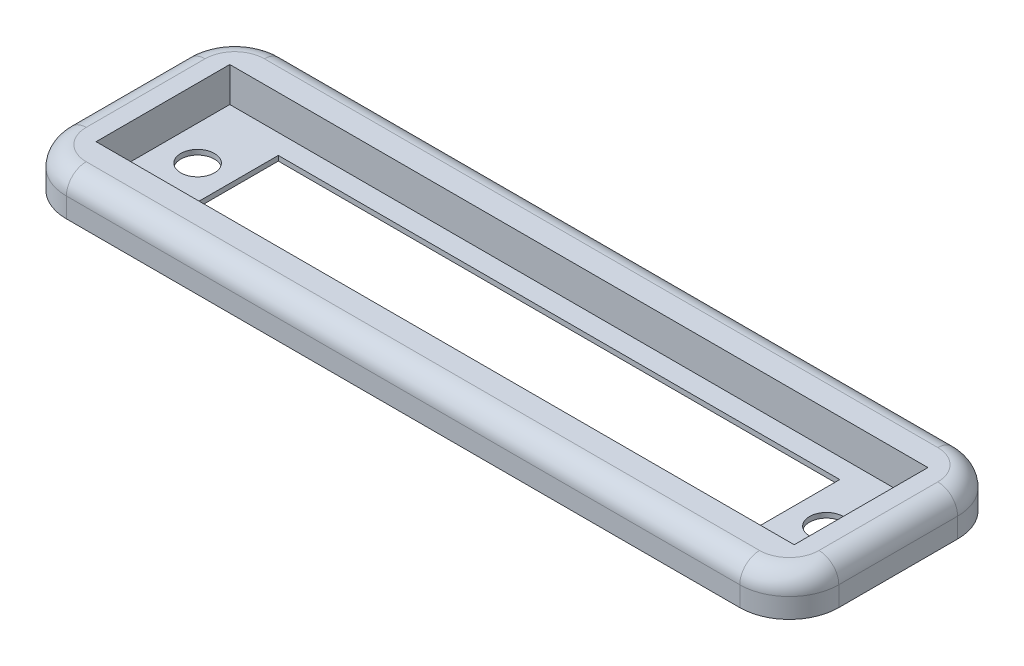
from build123d import *
from OCP.BRepFilletAPI import BRepFilletAPI_MakeFillet

# Parameters (mm, degrees)
SKETCH2_W           = 72
SKETCH2_H           = 18
SKETCH2_R           = 1.7
SKETCH2_W_2         = 56.7
SKETCH2_H_2         = 9.5
BOSS_EXTRUDE2_DEPTH = 0.5
SKETCH3_W           = 78
SKETCH3_H           = 22
SKETCH3_W_2         = 70.5
SKETCH3_H_2         = 13.5
BOSS_EXTRUDE3_DEPTH = 4
FILLET1_R1          = 5
FILLET1_R2          = 2


with BuildPart() as part:
    # Sketch2 → Boss-Extrude2 (new body)
    with BuildSketch(Plane(origin=(0, 0, 0), x_dir=(1, 0, 0), z_dir=(0, 1, 0))):
        Rectangle(SKETCH2_W, SKETCH2_H)
        with Locations((-31.75, 0)):
            Circle(SKETCH2_R, mode=Mode.SUBTRACT)
        with Locations((31.75, 0)):
            Circle(SKETCH2_R, mode=Mode.SUBTRACT)
        Rectangle(SKETCH2_W_2, SKETCH2_H_2, mode=Mode.SUBTRACT)
    extrude(amount=BOSS_EXTRUDE2_DEPTH)

    # Sketch3 → Boss-Extrude3 (add)
    with BuildSketch(Plane(origin=(0, 0, 0), x_dir=(1, 0, 0), z_dir=(0, 1, 0))):
        Rectangle(SKETCH3_W, SKETCH3_H)
        Rectangle(SKETCH3_W_2, SKETCH3_H_2, mode=Mode.SUBTRACT)
    extrude(amount=BOSS_EXTRUDE3_DEPTH)

    # Fillet1: one fillet with a radius per group of edges: ONE call of the kernel's fillet builder (fillet() takes one radius for all edges)
    fillet1_edges_1 = [part.edges().sort_by_distance(p)[0] for p in [
        (-39, 2, -11),
        (-39, 2, 11),
        (39, 2, 11),
        (39, 2, -11),
    ]]
    fillet1_edges_2 = [part.edges().sort_by_distance(p)[0] for p in [
        (0, 4, -11),
        (-39, 4, 0),
        (0, 4, 11),
        (39, 4, 0),
    ]]
    fillet1 = BRepFilletAPI_MakeFillet(part.part.solid().wrapped)
    for e in fillet1_edges_1:
        fillet1.Add(FILLET1_R1, e.wrapped)
    for e in fillet1_edges_2:
        fillet1.Add(FILLET1_R2, e.wrapped)
    add(Compound.cast(fillet1.Shape()), mode=Mode.REPLACE)


solid = part.part
